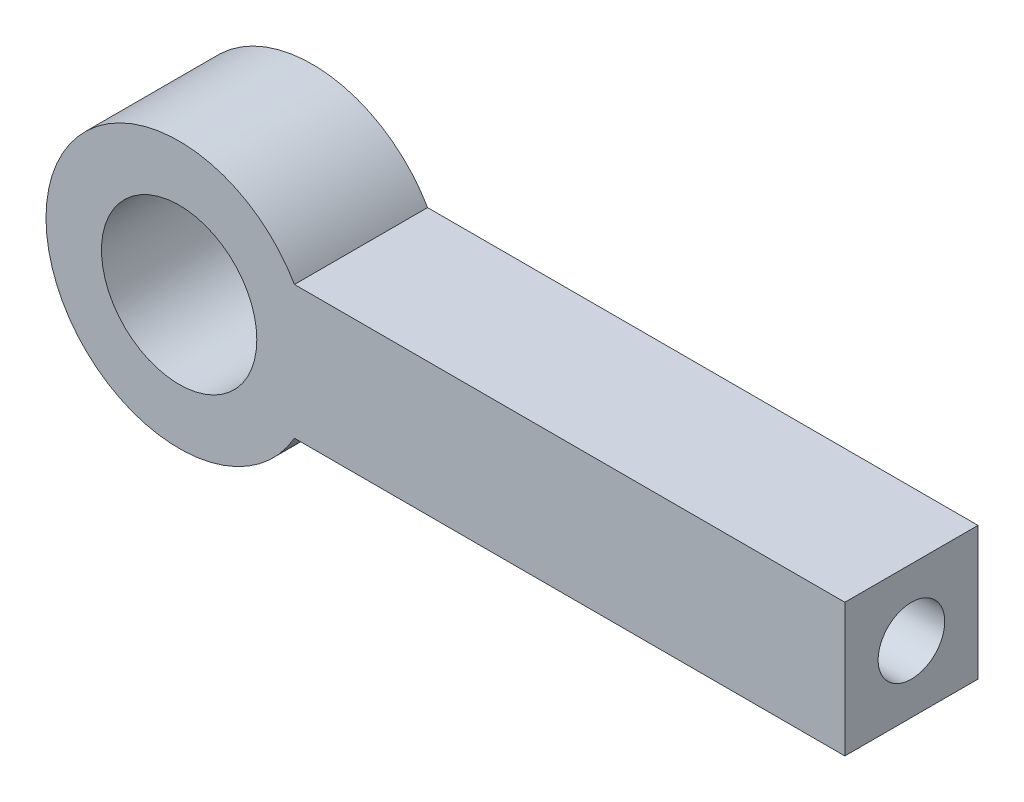
from build123d import *

# Parameters (mm, degrees)
BOSS_EXTRUDE1_DEPTH     = 3
CUT_EXTRUDE1_DEPTH      = 32.176914536
CUT_EXTRUDE1_DEPTH_BACK = 32.176914536
SKETCH10_R              = 3.5
SKETCH11_R              = 1.5
CUT_EXTRUDE2_DEPTH      = 20


with BuildPart() as part:
    # Sketch1 → Boss-Extrude1 (new, symmetric)
    with BuildSketch(Plane.XY):
        with BuildLine():
            Line((5.196152423, -3), (30, -3))
            Line((30, -3), (30, 3))
            Line((30, 3), (5.196152423, 3))
            ThreePointArc((5.196152423, 3), (-6, 0), (5.196152423, -3))
        make_face()
    extrude(amount=BOSS_EXTRUDE1_DEPTH, both=True)

    # Sketch10 → Cut-Extrude1 (cut, two sides: drawn at the far end of the back side and taken through both)
    with BuildSketch(Plane.XY.offset(3).offset(-CUT_EXTRUDE1_DEPTH_BACK)):
        Circle(SKETCH10_R)
    extrude(amount=CUT_EXTRUDE1_DEPTH + CUT_EXTRUDE1_DEPTH_BACK, mode=Mode.SUBTRACT)

    # Sketch11 → Cut-Extrude2 (cut)
    with BuildSketch(Plane(origin=(30, 0, 0), x_dir=(0, 0, -1), z_dir=(1, 0, 0))):
        Circle(SKETCH11_R)
    extrude(amount=-CUT_EXTRUDE2_DEPTH, mode=Mode.SUBTRACT)


solid = part.part
